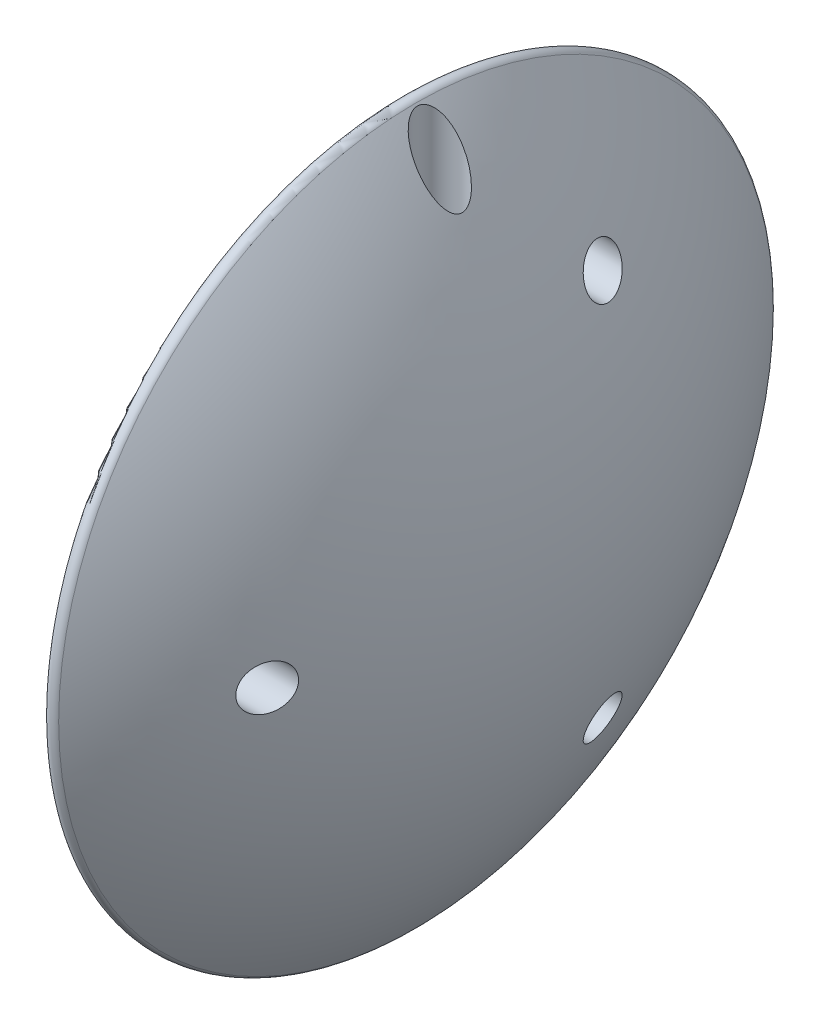
from build123d import *

# Parameters (mm, degrees)
CUT_EXTRUDE1_DEPTH      = 15
SKETCH3_R               = 1.4
CUT_EXTRUDE2_DEPTH      = 108.716624848
CUT_EXTRUDE3_START      = -20
SKETCH4_R               = 3
CUT_EXTRUDE3_DEPTH      = 88.716624907
FILLET1_R               = 1
CHAMFER1_SIZE           = 1
CUT_EXTRUDE4_DEPTH      = 71.620610943
CUT_EXTRUDE4_DEPTH_BACK = 71.620610943
SKETCH5_R               = 1.4
SKETCH5_R_2             = 1.400000586
CUT_EXTRUDE5_START      = -5
SKETCH6_R               = 3
CUT_EXTRUDE5_DEPTH      = 10


with BuildPart() as part:
    # Sketch1 → Revolve1 (revolve)
    with BuildSketch(Plane.XY):
        with BuildLine():
            Line((62.25, 50.248756204), (62.25, 0))
            Line((62.25, 0), (80, 0))
            ThreePointArc((80, 0), (75.432088663, 26.645825189), (62.25, 50.248756204))
        make_face()
    revolve(axis=Axis((62.25, 0, 0), (1, 0, 0)))

    # Sketch2 → Cut-Extrude1 (cut)
    with BuildSketch(Plane.ZY.offset(-62.25)):
        with BuildLine():
            Line((-1.322875656, 1.5), (1.322875656, 1.5))
            ThreePointArc((1.322875656, 1.5), (0, -2), (-1.322875656, 1.5))
        make_face()
    extrude(amount=-CUT_EXTRUDE1_DEPTH, mode=Mode.SUBTRACT)

    # Sketch3 → Cut-Extrude2 (cut, through all)
    with BuildSketch(Plane.XZ.offset(-1.5)):
        with Locations(Location((67.25, 0, 0), (0, 0, 289.106605351))):
            Circle(SKETCH3_R)
    extrude(amount=-CUT_EXTRUDE2_DEPTH, mode=Mode.SUBTRACT)

    # Sketch4 → Cut-Extrude3 (cut, through all)
    with BuildSketch(Plane.XZ.offset(-1.5).offset(CUT_EXTRUDE3_START)):
        with Locations(Location((67.25, 0, 0), (0, 0, 270))):
            Circle(SKETCH4_R)
    extrude(amount=-CUT_EXTRUDE3_DEPTH, mode=Mode.SUBTRACT)

    # Fillet1
    fillet1_edges = [part.edges().sort_by_distance(p)[0] for p in [
        (62.25, -50.248756204, 0),
    ]]
    fillet(fillet1_edges, radius=FILLET1_R)

    # Chamfer1
    chamfer1_edges = [part.edges().sort_by_distance(p)[0] for p in [
        (62.25, -2, 0),
        (62.25, 1.5, 0),
    ]]
    chamfer(chamfer1_edges, length=CHAMFER1_SIZE)

    # Sketch5 → Cut-Extrude4 (cut, two sides: drawn at the far end of the back side and taken through both)
    with BuildSketch(Plane.ZY.offset(-62.25).offset(-CUT_EXTRUDE4_DEPTH_BACK)):
        with Locations(Location((-15, -25.980762114, 0), (0, 0, 225.337584137))):
            Circle(SKETCH5_R)
        with Locations(Location((30, 0, 0), (0, 0, 317.351415887))):
            Circle(SKETCH5_R_2)
        with Locations(Location((-15, 25.980762114, 0), (0, 0, 199.114790126))):
            Circle(SKETCH5_R)
    extrude(amount=CUT_EXTRUDE4_DEPTH + CUT_EXTRUDE4_DEPTH_BACK, mode=Mode.SUBTRACT)

    # Sketch6 → Cut-Extrude5 (cut)
    with BuildSketch(Plane.ZY.offset(-62.25).offset(CUT_EXTRUDE5_START)):
        with Locations((-15, 25.980762114)):
            Circle(SKETCH6_R)
        with Locations((30, 0)):
            Circle(SKETCH6_R)
        with Locations((-15, -25.980762114)):
            Circle(SKETCH6_R)
    extrude(amount=-CUT_EXTRUDE5_DEPTH, mode=Mode.SUBTRACT)


solid = part.part
